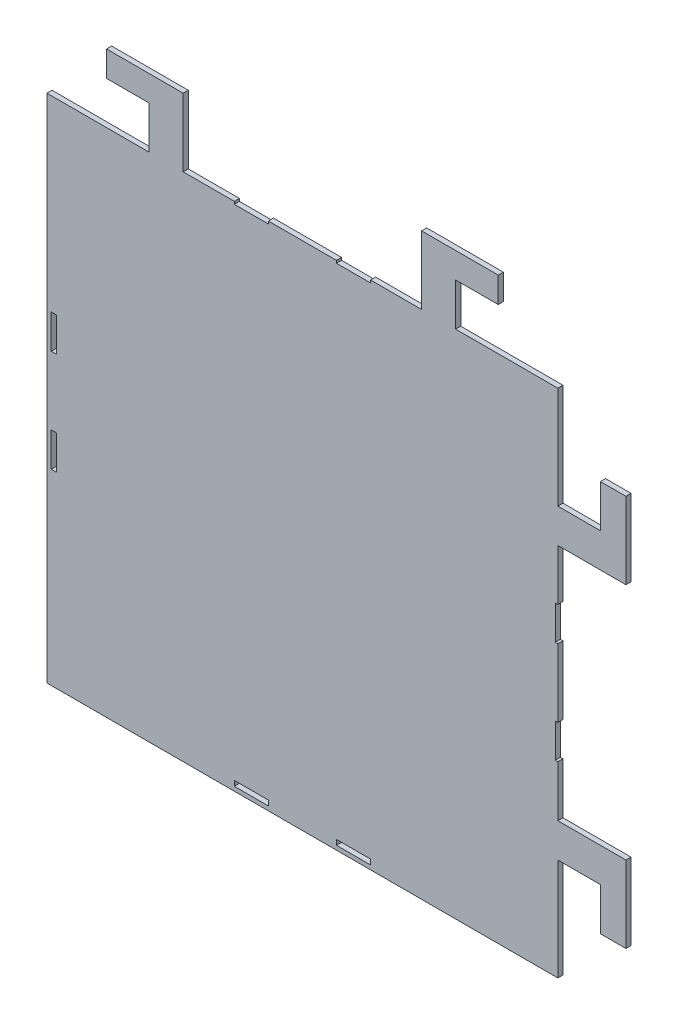
from build123d import *

# Parameters (mm, degrees)
ESBO_O1_W                = 20
ESBO_O1_H                = 3
ESBO_O1_W_2              = 3
ESBO_O1_H_2              = 20
RESSALTO_EXTRUS_O1_DEPTH = 3


with BuildPart() as part:
    # Esboço1 → Ressalto-extrusão1 (new body)
    with BuildSketch(Plane.XY):
        Polygon((208.901159766, 291.53692045), (233.901159766, 291.53692045), (233.901159766, 306.53692045), (188.901159766, 306.53692045), (188.901159766, 266.53692045), (158.901159766, 266.53692045), (158.901159766, 265.03692045), (138.901159766, 265.03692045), (138.901159766, 266.53692045), (98.901159766, 266.53692045), (98.901159766, 265.03692045), (78.901159766, 265.03692045), (78.901159766, 266.53692045), (48.901159766, 266.53692045), (48.901159766, 306.53692045), (3.901159766, 306.53692045), (3.901159766, 291.53692045), (28.901159766, 291.53692045), (28.901159766, 266.53692045), (-31.098840234, 266.53692045), (-31.098840234, -33.46307955), (268.901159766, -33.46307955), (268.901159766, 26.53692045), (293.901159766, 26.53692045), (293.901159766, 1.53692045), (308.901159766, 1.53692045), (308.901159766, 46.53692045), (268.901159766, 46.53692045), (268.901159766, 76.53692045), (267.401159766, 76.53692045), (267.401159766, 96.53692045), (268.901159766, 96.53692045), (268.901159766, 136.53692045), (267.401159766, 136.53692045), (267.401159766, 156.53692045), (268.901159766, 156.53692045), (268.901159766, 186.53692045), (308.901159766, 186.53692045), (308.901159766, 231.53692045), (293.901159766, 231.53692045), (293.901159766, 206.53692045), (268.901159766, 206.53692045), (268.901159766, 266.53692045), (208.901159766, 266.53692045), align=None)
        with Locations((88.901159766, -29.46307955)):
            Rectangle(ESBO_O1_W, ESBO_O1_H, mode=Mode.SUBTRACT)
        with Locations((148.901159766, -29.46307955)):
            Rectangle(ESBO_O1_W, ESBO_O1_H, mode=Mode.SUBTRACT)
        with Locations((-27.098840234, 146.53692045)):
            Rectangle(ESBO_O1_W_2, ESBO_O1_H_2, mode=Mode.SUBTRACT)
        with Locations((-27.098840234, 86.53692045)):
            Rectangle(ESBO_O1_W_2, ESBO_O1_H_2, mode=Mode.SUBTRACT)
    extrude(amount=RESSALTO_EXTRUS_O1_DEPTH)


solid = part.part
